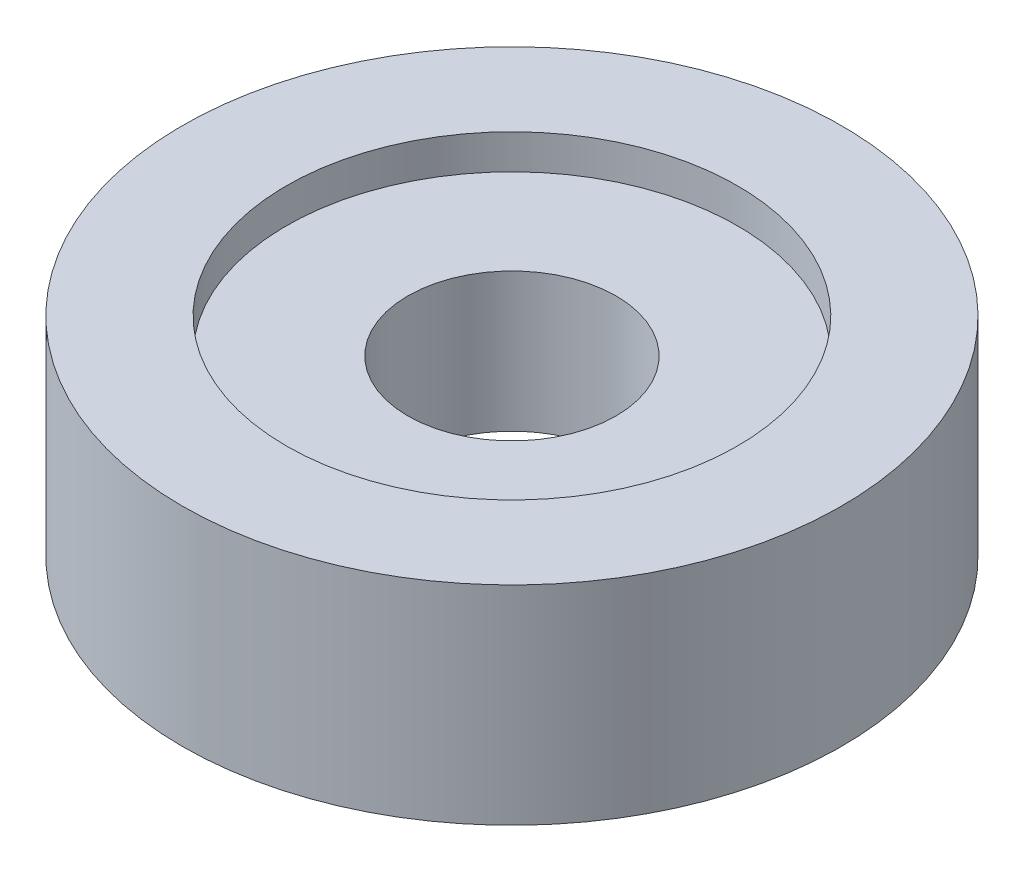
from build123d import *

# Parameters (mm, degrees)
SKETCH1_R           = 9.5
BOSS_EXTRUDE1_DEPTH = 6
SKETCH2_R           = 6.5
CUT_EXTRUDE1_DEPTH  = 1
SKETCH3_R           = 3
CUT_EXTRUDE2_DEPTH  = 15.335271187


with BuildPart() as part:
    # Sketch1 → Boss-Extrude1 (new body)
    with BuildSketch(Plane(origin=(0, 0, 0), x_dir=(1, 0, 0), z_dir=(0, 1, 0))):
        with Locations(Location((0, 0, 0), (0, 0, 270))):
            Circle(SKETCH1_R)
    extrude(amount=BOSS_EXTRUDE1_DEPTH)

    # Sketch2 → Cut-Extrude1 (cut)
    with BuildSketch(Plane(origin=(0, 6, 0), x_dir=(1, 0, 0), z_dir=(0, 1, 0))):
        with Locations(Location((0, 0, 0), (0, 0, 270))):
            Circle(SKETCH2_R)
    cut_extrude1 = extrude(amount=-CUT_EXTRUDE1_DEPTH, mode=Mode.SUBTRACT)

    # Sketch3 → Cut-Extrude2 (cut, through all)
    with BuildSketch(Plane(origin=(0, 5, 0), x_dir=(1, 0, 0), z_dir=(0, 1, 0))):
        with Locations(Location((0, 0, 0), (0, 0, 270))):
            Circle(SKETCH3_R)
    extrude(amount=-CUT_EXTRUDE2_DEPTH, mode=Mode.SUBTRACT)

    # Mirror1: Cut-Extrude1 across plane
    add(cut_extrude1.mirror(Plane.ZX.offset(3)), mode=Mode.SUBTRACT)


solid = part.part
